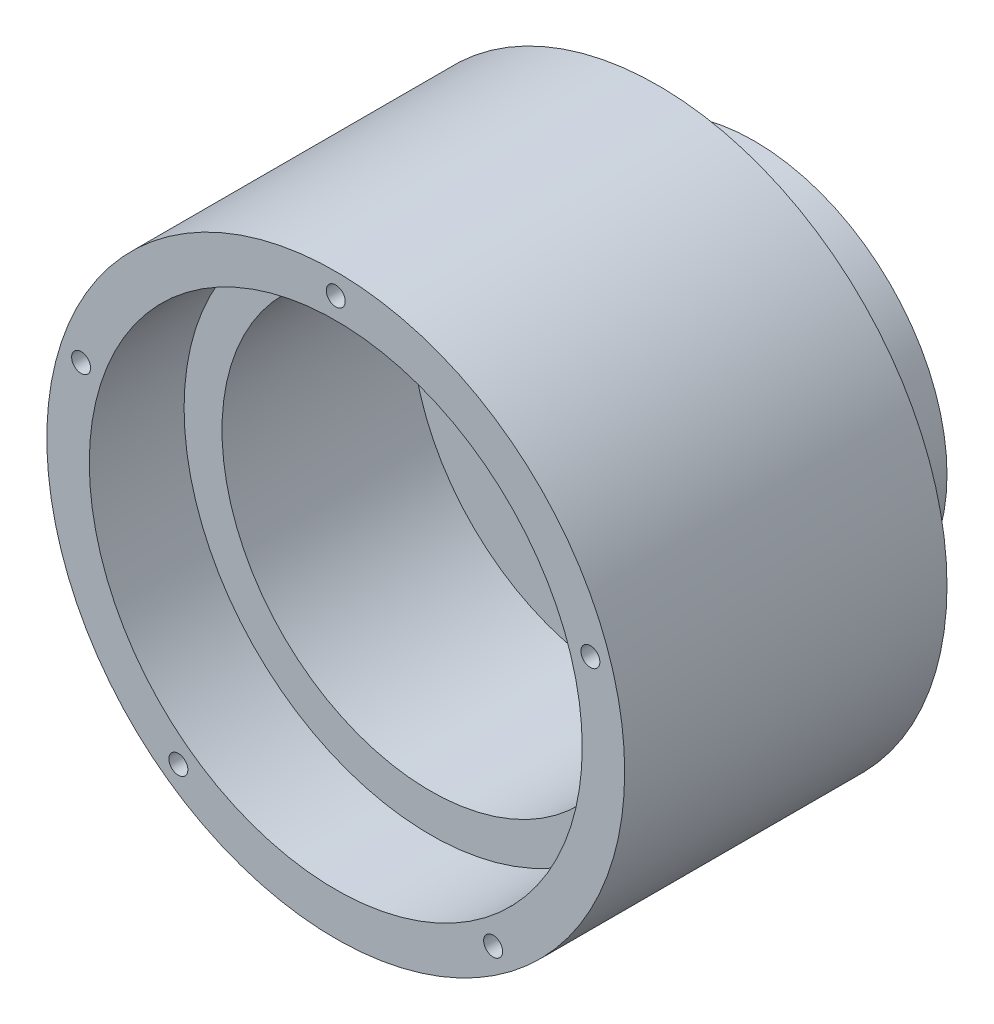
from build123d import *

# Parameters (mm, degrees)
SKETCH2_R               = 76.2
BOSS_EXTRUDE1_DEPTH     = 85
SKETCH4_R               = 65
CUT_EXTRUDE2_DEPTH      = 25
SKETCH5_R               = 55
CUT_EXTRUDE3_DEPTH      = 50
SKETCH7_R               = 2.5
CUT_EXTRUDE4_DEPTH      = 20
CIRPATTERN1_COUNT       = 5
SKETCH8_R               = 50.8
BOSS_EXTRUDE3_DEPTH     = 25.4
CUT_EXTRUDE5_DEPTH      = 155.275856828
CUT_EXTRUDE5_DEPTH_BACK = 155.275856828
SKETCH10_R              = 38.1
CUT_EXTRUDE6_START      = -25.4
SKETCH11_R              = 2.54
CUT_EXTRUDE6_DEPTH      = 163.651156644
CIRPATTERN2_COUNT       = 5


with BuildPart() as part:
    # Sketch2 → Boss-Extrude1 (new body)
    with BuildSketch(Plane(origin=(0, 0, 0), x_dir=(0, 1, 0), z_dir=(0, 0, 1))):
        with Locations(Location((0, 0, 0), (0, 0, 270))):
            Circle(SKETCH2_R)
    extrude(amount=BOSS_EXTRUDE1_DEPTH)

    # Sketch4 → Cut-Extrude2 (cut)
    with BuildSketch(Plane.XY.offset(85)):
        Circle(SKETCH4_R)
    extrude(amount=-CUT_EXTRUDE2_DEPTH, mode=Mode.SUBTRACT)

    # Sketch5 → Cut-Extrude3 (cut)
    with BuildSketch(Plane.XY.offset(60)):
        Circle(SKETCH5_R)
    extrude(amount=-CUT_EXTRUDE3_DEPTH, mode=Mode.SUBTRACT)

    # Sketch7 → Cut-Extrude4 (cut)
    with BuildSketch(Plane.XY.offset(85)):
        with Locations((0, 70.612)):
            Circle(SKETCH7_R)
    cut_extrude4 = extrude(amount=-CUT_EXTRUDE4_DEPTH, mode=Mode.SUBTRACT)

    # CirPattern1: Cut-Extrude4 ×5 about axis
    cirpattern1_axis = Axis((0, 0, 0), (0, 0, 1))
    for i in range(1, CIRPATTERN1_COUNT):
        add(cut_extrude4.rotate(cirpattern1_axis, i * 360 / CIRPATTERN1_COUNT), mode=Mode.SUBTRACT)

    # Sketch8 → Boss-Extrude3 (add)
    with BuildSketch(Plane(origin=(0, 0, 0), x_dir=(1, 0, 0), z_dir=(0, 0, -1))):
        Circle(SKETCH8_R)
    extrude(amount=BOSS_EXTRUDE3_DEPTH)

    # Sketch10 → Cut-Extrude5 (cut, two sides: drawn at the far end of the back side and taken through both)
    with BuildSketch(Plane(origin=(0, 0, -25.4), x_dir=(1, 0, 0), z_dir=(0, 0, -1)).offset(-CUT_EXTRUDE5_DEPTH_BACK)):
        with Locations(Location((0, 0, 0), (0, 0, 180))):
            Circle(SKETCH10_R)
    extrude(amount=CUT_EXTRUDE5_DEPTH + CUT_EXTRUDE5_DEPTH_BACK, mode=Mode.SUBTRACT)

    # Sketch11 → Cut-Extrude6 (cut)
    with BuildSketch(Plane(origin=(0, 0, 0), x_dir=(1, 0, 0), z_dir=(0, 0, -1)).offset(CUT_EXTRUDE6_START)):
        with Locations((0, 69.85)):
            Circle(SKETCH11_R)
    cut_extrude6 = extrude(amount=CUT_EXTRUDE6_DEPTH, mode=Mode.SUBTRACT)

    # CirPattern2: Cut-Extrude6 ×5 about axis
    cirpattern2_axis = Axis((0, 0, 0), (0, 0, 1))
    for i in range(1, CIRPATTERN2_COUNT):
        add(cut_extrude6.rotate(cirpattern2_axis, i * 360 / CIRPATTERN2_COUNT), mode=Mode.SUBTRACT)


solid = part.part
